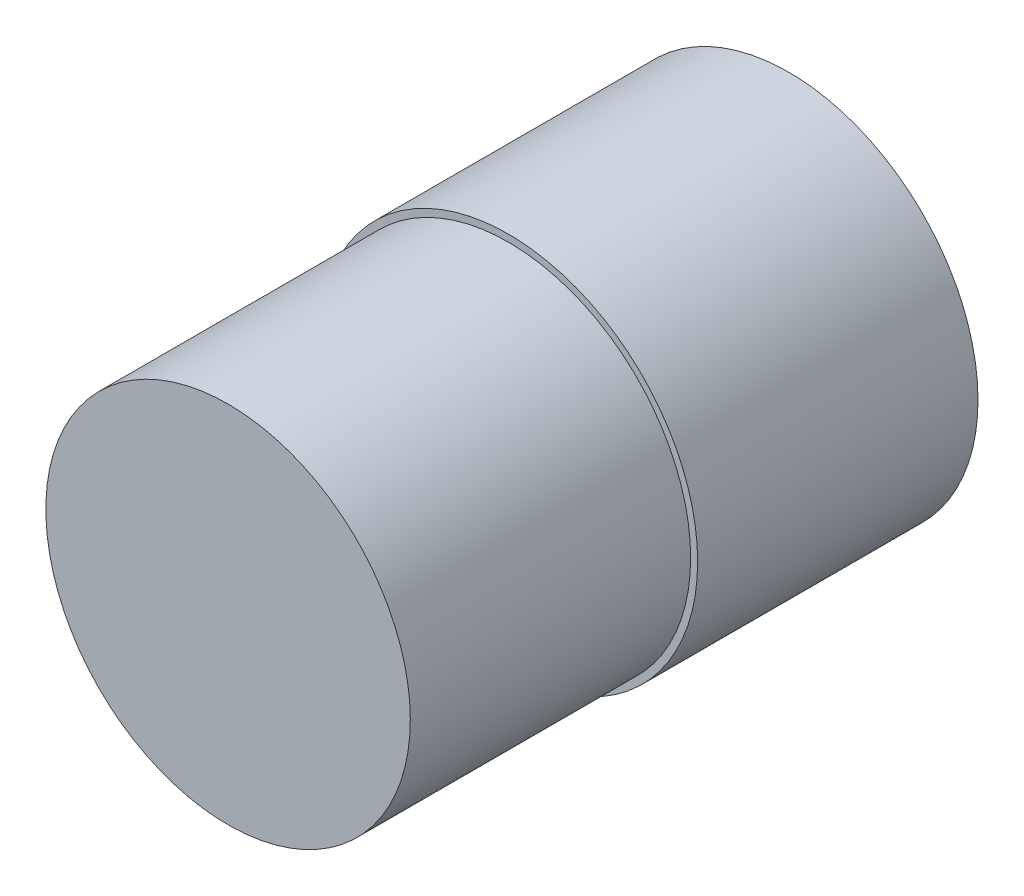
from build123d import *

# Parameters (mm, degrees)
SKETCH1_R           = 6.75
SKETCH1_R_2         = 2.725
BOSS_EXTRUDE2_DEPTH = 10
SKETCH2_R           = 6.6
BOSS_EXTRUDE3_DEPTH = 10
CUT_EXTRUDE1_START  = -10
SKETCH3_R           = 6.6
SKETCH3_R_2         = 6.5
CUT_EXTRUDE1_DEPTH  = 10


with BuildPart() as part:
    # Sketch1 → Boss-Extrude2 (new body)
    with BuildSketch(Plane.XY):
        Circle(SKETCH1_R)
        Circle(SKETCH1_R_2, mode=Mode.SUBTRACT)
    extrude(amount=BOSS_EXTRUDE2_DEPTH)

    # Sketch2 → Boss-Extrude3 (add)
    with BuildSketch(Plane.XY.offset(10)):
        Circle(SKETCH2_R)
    extrude(amount=BOSS_EXTRUDE3_DEPTH)

    # Sketch3 → Cut-Extrude1 (cut)
    with BuildSketch(Plane.XY.offset(20).offset(CUT_EXTRUDE1_START)):
        Circle(SKETCH3_R)
        Circle(SKETCH3_R_2, mode=Mode.SUBTRACT)
    extrude(amount=CUT_EXTRUDE1_DEPTH, mode=Mode.SUBTRACT)


solid = part.part
